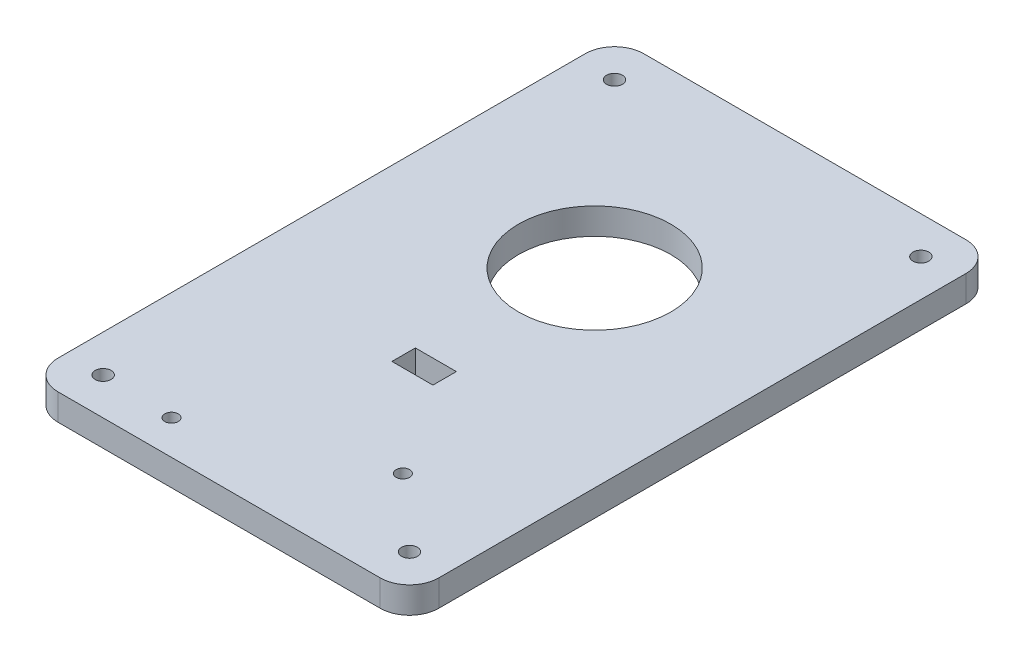
from build123d import *

# Parameters (mm, degrees)
SKETCH2_W                          = 65
SKETCH2_H                          = 100
BOSS_EXTRUDE1_DEPTH                = 4.5
F_36_0_1065_DIAMETER_HOLE1_D       = 2.7051
FILLET1_R                          = 5
TAP_DRILL_FOR_M2_2_HELICOIL1_D     = 2.3
TAP_DRILL_FOR_M2_2_HELICOIL1_DEPTH = 4.5
TAP_DRILL_FOR_M2_2_HELICOIL1_TIP   = 0.690989712
SKETCH14_W                         = 7
SKETCH14_H                         = 4
CUT_EXTRUDE1_DEPTH                 = 10
SKETCH16_R                         = 13
CUT_EXTRUDE2_DEPTH                 = 17


with BuildPart() as part:
    # Sketch2 → Boss-Extrude1 (new body)
    with BuildSketch(Plane(origin=(0, 0, 0), x_dir=(1, 0, 0), z_dir=(0, 1, 0))):
        Rectangle(SKETCH2_W, SKETCH2_H)
    extrude(amount=BOSS_EXTRUDE1_DEPTH)

    # #36 (0.1065) Diameter Hole1 (through all)
    with Locations(Plane(origin=(0, 4.5, 0), x_dir=(1, 0, 0), z_dir=(0, 1, 0))):
        with Locations((-26.15, 43.65), (26.15, 43.65), (26.15, -43.65), (-26.15, -43.65)):
            Hole(F_36_0_1065_DIAMETER_HOLE1_D / 2)

    # Fillet1
    fillet1_edges = [part.edges().sort_by_distance(p)[0] for p in [
        (32.5, 2.25, 50),
        (-32.5, 2.25, 50),
        (-32.5, 2.25, -50),
        (32.5, 2.25, -50),
    ]]
    fillet(fillet1_edges, radius=FILLET1_R)

    # Tap Drill for M2.2 Helicoil1
    with Locations(Plane(origin=(0, 4.5, 0), x_dir=(1, 0, 0), z_dir=(0, 1, 0))):
        with Locations((14, -32.631381325), (-14, -44.131381325)):
            Hole(TAP_DRILL_FOR_M2_2_HELICOIL1_D / 2, depth=TAP_DRILL_FOR_M2_2_HELICOIL1_DEPTH)
            with Locations((0, 0, -(TAP_DRILL_FOR_M2_2_HELICOIL1_DEPTH + TAP_DRILL_FOR_M2_2_HELICOIL1_TIP / 2))):  # 118° drill point
                Cone(0, TAP_DRILL_FOR_M2_2_HELICOIL1_D / 2, TAP_DRILL_FOR_M2_2_HELICOIL1_TIP, mode=Mode.SUBTRACT)

    # Sketch14 → Cut-Extrude1 (cut)
    with BuildSketch(Plane(origin=(0, 4.5, 0), x_dir=(1, 0, 0), z_dir=(0, 1, 0))):
        with Locations((0, -15)):
            Rectangle(SKETCH14_W, SKETCH14_H)
    extrude(amount=-CUT_EXTRUDE1_DEPTH, mode=Mode.SUBTRACT)

    # Sketch16 → Cut-Extrude2 (cut)
    with BuildSketch(Plane(origin=(0, 4.5, 0), x_dir=(1, 0, 0), z_dir=(0, 1, 0))):
        with Locations(Location((0, 14.115370647, 0), (0, 0, 270))):
            Circle(SKETCH16_R)
    extrude(amount=-CUT_EXTRUDE2_DEPTH, mode=Mode.SUBTRACT)


solid = part.part
